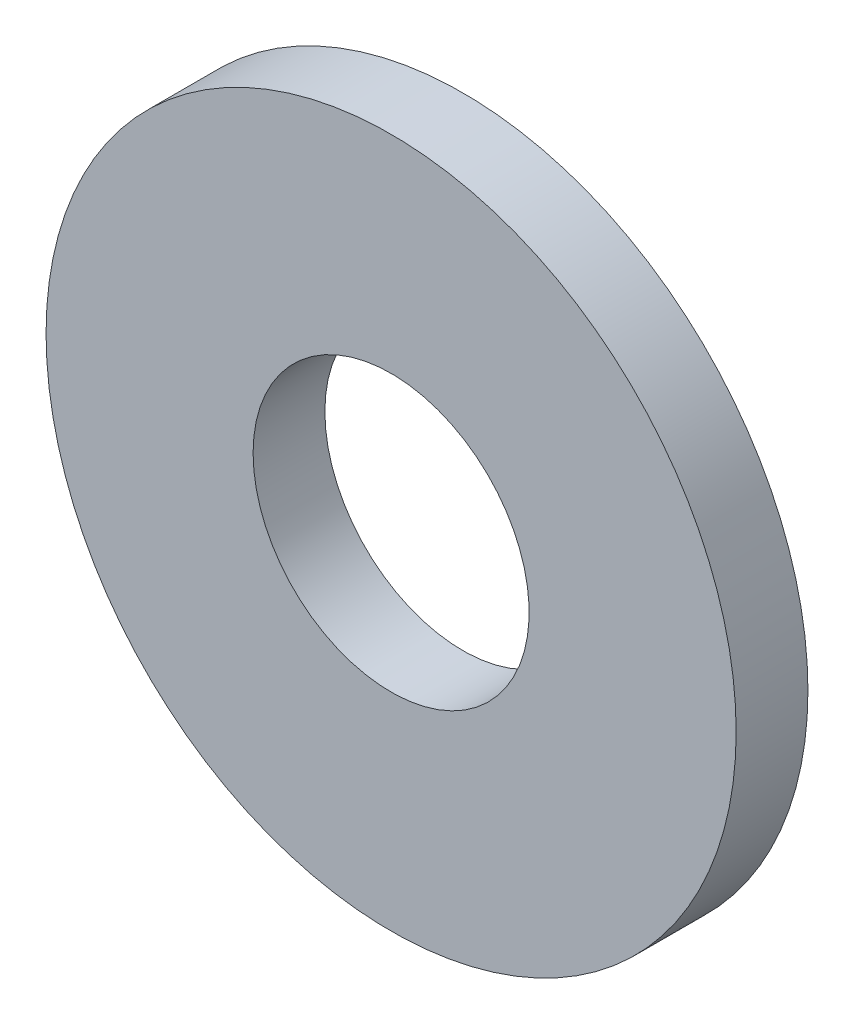
from build123d import *

# Parameters (mm, degrees)
SKETCH1_R           = 7.9375
SKETCH1_R_2         = 3.175
BOSS_EXTRUDE1_DEPTH = 1.651


with BuildPart() as part:
    # Sketch1 → Boss-Extrude1 (new body)
    with BuildSketch(Plane.XY):
        with Locations(Location((0, 0, 0), (0, 0, 180))):
            Circle(SKETCH1_R)
        with Locations(Location((0, 0, 0), (0, 0, 180))):
            Circle(SKETCH1_R_2, mode=Mode.SUBTRACT)
    extrude(amount=BOSS_EXTRUDE1_DEPTH)


solid = part.part
